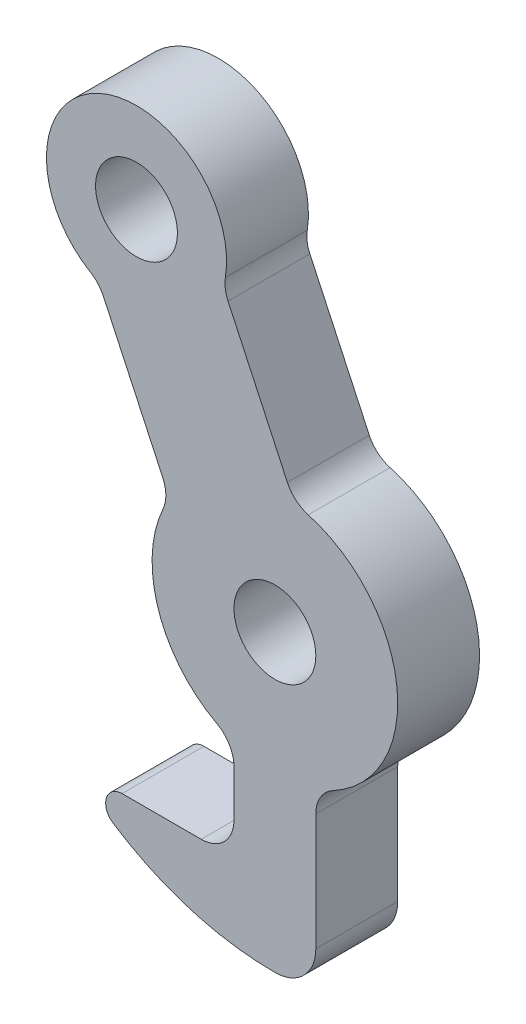
from build123d import *

# Parameters (mm, degrees)
SKETCH1_R           = 3.175
BOSS_EXTRUDE1_DEPTH = 3.175
FILLET1_R           = 2.54
FILLET2_R           = 1.27


with BuildPart() as part:
    # Sketch1 → Boss-Extrude1 (new, symmetric)
    with BuildSketch(Plane.XY):
        with BuildLine():
            Line((1.499199331, 9.406275903), (-3.9943168, 21.187159265))
            ThreePointArc((-3.9943168, 21.187159265), (-13.686492406, 29.350777683), (-13.662808272, 16.678667649))
            Line((-13.662808272, 16.678667649), (-8.169292141, 4.897784287))
            ThreePointArc((-8.169292141, 4.897784287), (-8.962323495, -3.225272479), (-3.175, -8.980256121))
            Line((-3.175, -8.980256121), (-3.175, -16.773611102))
            Line((-3.175, -16.773611102), (-15.531438137, -16.773611102))
            ThreePointArc((-15.531438137, -16.773611102), (-8.340708909, -21.284082665), (0, -22.86))
            ThreePointArc((0, -22.86), (2.24506403, -21.93006403), (3.175, -19.685))
            Line((3.175, -19.685), (3.175, -8.980256121))
            ThreePointArc((3.175, -8.980256121), (9.485682623, 0.864552013), (1.499199331, 9.406275903))
        make_face()
        with Locations((-10.734503848, 23.020217791)):
            Circle(SKETCH1_R, mode=Mode.SUBTRACT)
        Circle(SKETCH1_R, mode=Mode.SUBTRACT)
    extrude(amount=BOSS_EXTRUDE1_DEPTH, both=True)

    # Fillet1
    fillet1_edges = [part.edges().sort_by_distance(p)[0] for p in [
        (-3.175, -16.773611102, 0),
        (-3.175, -8.980256121, 0),
        (-8.169292141, 4.897784287, 0),
        (-13.662808272, 16.678667649, 0),
        (-3.9943168, 21.187159265, 0),
        (1.499199331, 9.406275903, 0),
        (3.175, -8.980256121, 0),
    ]]
    fillet(fillet1_edges, radius=FILLET1_R)

    # Fillet2
    fillet2_edges = [part.edges().sort_by_distance(p)[0] for p in [
        (-15.531438137, -16.773611102, 0),
    ]]
    fillet(fillet2_edges, radius=FILLET2_R)


solid = part.part
